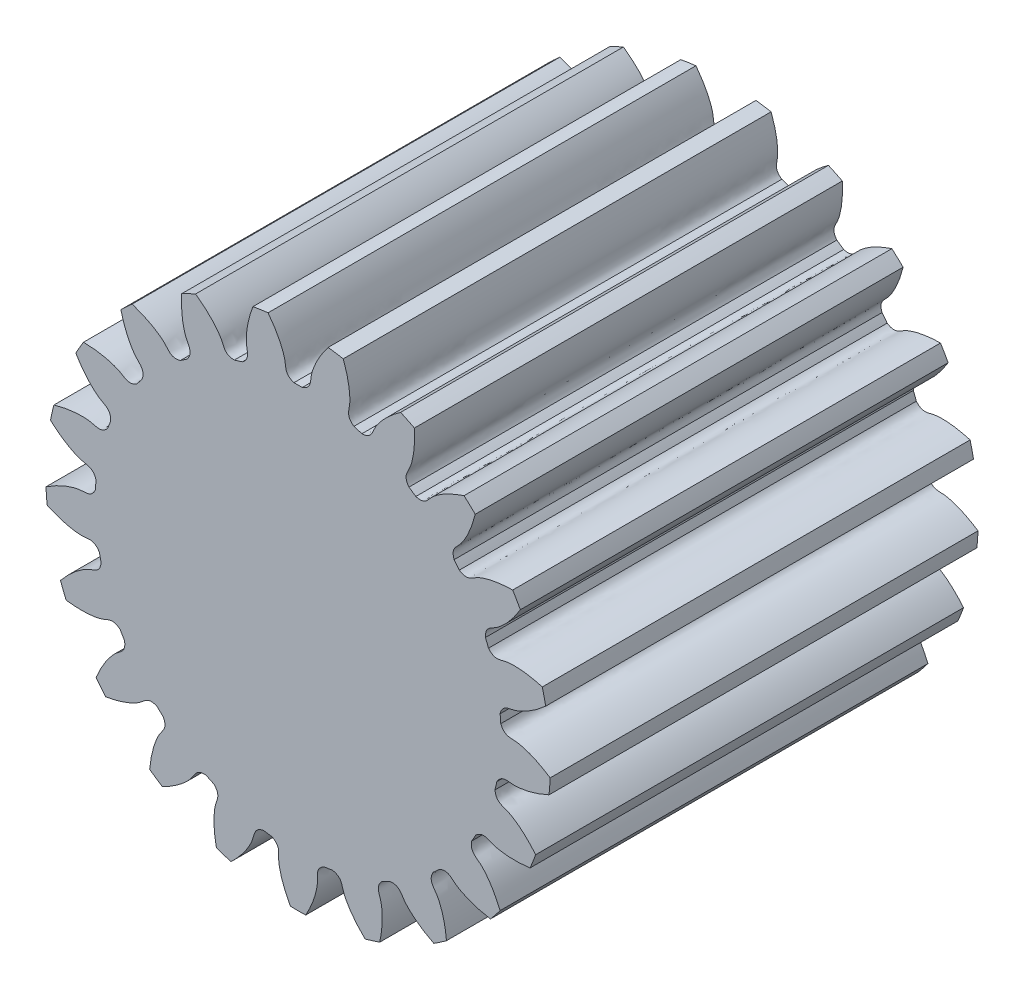
from build123d import *

# Parameters (mm, degrees)
SKETCH_1_R               = 11.5
EXTRUDE_1_DEPTH          = 30
CUT_EXTRUDE_1_DEPTH      = 35.124771062
PATTERN_CIRCULAR_1_COUNT = 21
SKETCH_4_R               = 21.65313607
CUT_EXTRUDE_2_DEPTH      = 10.5


with BuildPart() as part:
    # 草图1 → 凸台-拉伸1 (new body)
    with BuildSketch(Plane.XY):
        Circle(SKETCH_1_R)
    extrude(amount=EXTRUDE_1_DEPTH)

    # 草图2 → 切除-拉伸1 (cut, through all)
    with BuildSketch(Plane.XY):
        with BuildLine():
            ThreePointArc((0.189659364, 9.248055435), (0, 9.25), (-0.189659364, 9.248055435))
            add(Edge.make_bspline(
                [(-0.189659364, 9.248055435), (-0.599275792, 9.385103865), (-0.552794378, 9.669534944), (-0.606239686, 9.945853783), (-0.612425865, 9.974801824), (-0.620093102, 10.007462694), (-0.629387162, 10.04378815), (-0.640458841, 10.083724352), (-0.653455365, 10.127213306), (-0.668522962, 10.174192455), (-0.685805897, 10.224594862), (-0.705446622, 10.278349215), (-0.727585571, 10.335379887), (-0.752361074, 10.395606984), (-0.779909234, 10.458946404), (-0.810363816, 10.525309889), (-0.843856134, 10.594605091), (-0.880514945, 10.666735631), (-0.920466335, 10.741601167), (-0.963833617, 10.819097463), (-1.010737224, 10.899116461), (-1.061294605, 10.981546352), (-1.115620125, 11.066271655), (-1.173824965, 11.153173298), (-1.236017024, 11.242128693), (-1.302300822, 11.33301183), (-1.372777411, 11.425693355), (-1.447544278, 11.520040661), (-1.52669526, 11.615917985), (-1.610320453, 11.713186492), (-1.698506133, 11.811704378), (-1.791334666, 11.911326967), (-1.888884436, 12.011906807), (-1.99122976, 12.113293775), (-2.098440819, 12.215335182), (-2.210583582, 12.317875876), (-2.327719738, 12.420758351), (-2.449906625, 12.523822859), (-2.577197175, 12.626907516), (-2.709639819, 12.729848422), (-2.89526755, 12.868263106), (-3.039212176, 12.968950724), (-3.137541087, 13.034906378)],
                knots=[0, 0, 0, 0, 0.161234605, 0.166476889, 0.172525678, 0.179380972, 0.187042772, 0.195511076, 0.204785886, 0.214867201, 0.225755021, 0.237449346, 0.249950177, 0.263257512, 0.277371353, 0.292291699, 0.30801855, 0.324551907, 0.341891768, 0.360038135, 0.378991007, 0.398750384, 0.419316266, 0.440688653, 0.462867546, 0.485852944, 0.509644847, 0.534243255, 0.559648168, 0.585859587, 0.612877511, 0.64070194, 0.669332874, 0.698770313, 0.729014258, 0.760064707, 0.791921662, 0.824585122, 0.858055087, 0.892331558, 0.927414533, 1, 1, 1, 1], degree=3))
            ThreePointArc((-3.137541087, 13.034906378), (0, 13.407197632), (3.137541087, 13.034906378))
            add(Edge.make_bspline(
                [(0.189659364, 9.248055435), (0.599275792, 9.385103865), (0.552794378, 9.669534944), (0.606239686, 9.945853783), (0.612425865, 9.974801824), (0.620093102, 10.007462694), (0.629387162, 10.04378815), (0.640458841, 10.083724352), (0.653455365, 10.127213306), (0.668522962, 10.174192455), (0.685805897, 10.224594862), (0.705446622, 10.278349215), (0.727585571, 10.335379887), (0.752361074, 10.395606984), (0.779909234, 10.458946404), (0.810363816, 10.525309889), (0.843856134, 10.594605091), (0.880514945, 10.666735631), (0.920466335, 10.741601167), (0.963833617, 10.819097463), (1.010737224, 10.899116461), (1.061294605, 10.981546352), (1.115620125, 11.066271655), (1.173824965, 11.153173298), (1.236017024, 11.242128693), (1.302300822, 11.33301183), (1.372777411, 11.425693355), (1.447544278, 11.520040661), (1.52669526, 11.615917985), (1.610320453, 11.713186492), (1.698506133, 11.811704378), (1.791334666, 11.911326967), (1.888884436, 12.011906807), (1.99122976, 12.113293775), (2.098440819, 12.215335182), (2.210583582, 12.317875876), (2.327719738, 12.420758351), (2.449906625, 12.523822859), (2.577197175, 12.626907516), (2.709639819, 12.729848422), (2.89526755, 12.868263106), (3.039212176, 12.968950724), (3.137541087, 13.034906378)],
                knots=[0, 0, 0, 0, 0.161234605, 0.166476889, 0.172525678, 0.179380972, 0.187042772, 0.195511076, 0.204785886, 0.214867201, 0.225755021, 0.237449346, 0.249950177, 0.263257512, 0.277371353, 0.292291699, 0.30801855, 0.324551907, 0.341891768, 0.360038135, 0.378991007, 0.398750384, 0.419316266, 0.440688653, 0.462867546, 0.485852944, 0.509644847, 0.534243255, 0.559648168, 0.585859587, 0.612877511, 0.64070194, 0.669332874, 0.698770313, 0.729014258, 0.760064707, 0.791921662, 0.824585122, 0.858055087, 0.892331558, 0.927414533, 1, 1, 1, 1], degree=3))
        make_face()
    cut_extrude_1 = extrude(amount=CUT_EXTRUDE_1_DEPTH, mode=Mode.SUBTRACT)

    # 阵列(圆周)1: 切除-拉伸1 ×21 about axis
    pattern_circular_1_axis = Axis((0, 0, -1.5), (0, 0, 1))
    for i in range(1, PATTERN_CIRCULAR_1_COUNT):
        add(cut_extrude_1.rotate(pattern_circular_1_axis, i * 360 / PATTERN_CIRCULAR_1_COUNT), mode=Mode.SUBTRACT)

    # 草图4 → 切除-拉伸2 (cut)
    with BuildSketch(Plane.XY.offset(30)):
        Circle(SKETCH_4_R)
    extrude(amount=-CUT_EXTRUDE_2_DEPTH, mode=Mode.SUBTRACT)


solid = part.part
